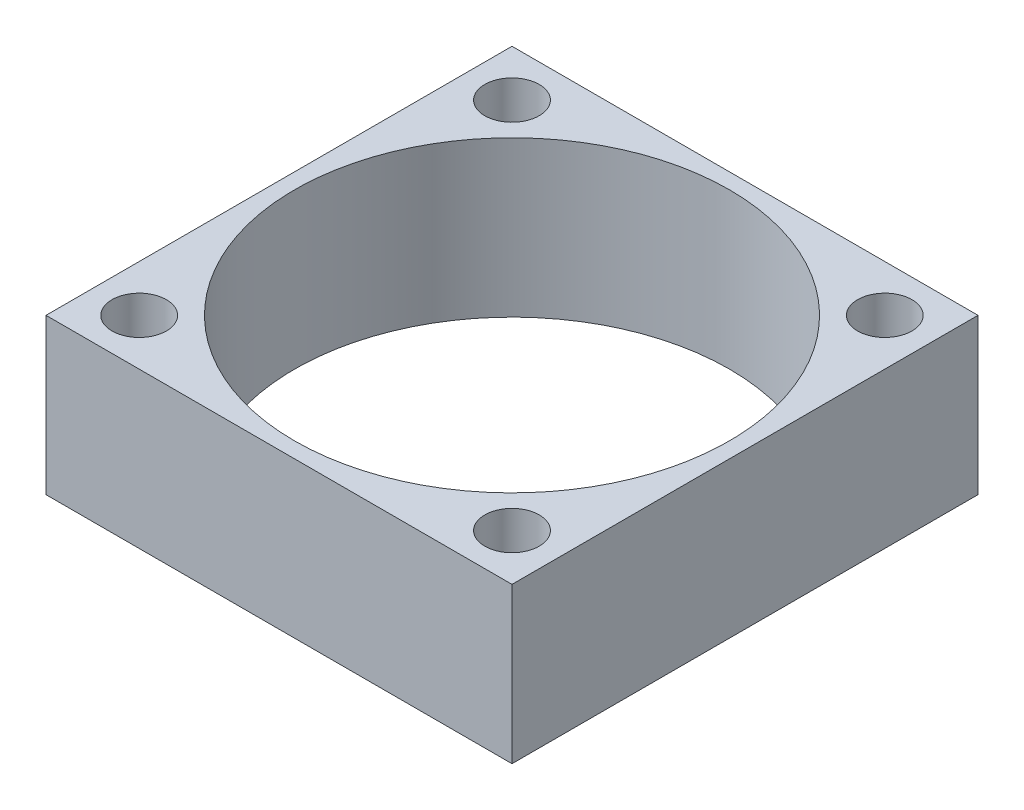
from build123d import *

# Parameters (mm, degrees)
SKETCH_1_W              = 30
SKETCH_1_H              = 30
SKETCH_1_R              = 14
EXTRUDE_1_DEPTH         = 10
HOLE_WIZARD_3_5_3_5_1_D = 3.5


with BuildPart() as part:
    # Эскиз1 → Бобышка-Вытянуть1 (new body)
    with BuildSketch(Plane(origin=(0, 0, 0), x_dir=(1, 0, 0), z_dir=(0, 1, 0))):
        with Locations((15, 15)):
            Rectangle(SKETCH_1_W, SKETCH_1_H)
        with Locations(Location((15, 15, 0), (0, 0, 270))):
            Circle(SKETCH_1_R, mode=Mode.SUBTRACT)
    extrude(amount=EXTRUDE_1_DEPTH)

    # Диаметр отверстия Ø3.5 (3.5)1 (through all)
    with Locations(Plane(origin=(0, 10, 0), x_dir=(1, 0, 0), z_dir=(0, 1, 0))):
        with Locations((3, 27), (27, 27), (27, 3), (3, 3)):
            Hole(HOLE_WIZARD_3_5_3_5_1_D / 2)


solid = part.part
